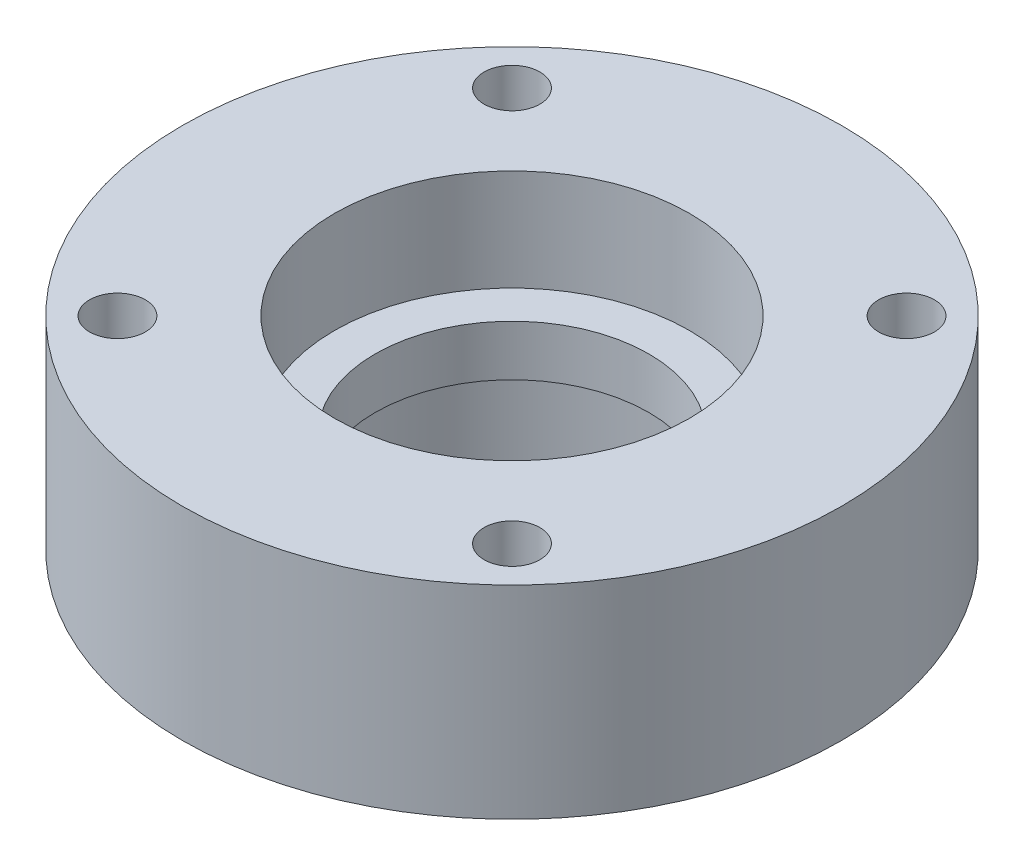
from build123d import *

# Parameters (mm, degrees)
HOLE_WIZARD_M51_D = 5.5


with BuildPart() as part:
    # Эскиз1 → Повернуть1 (revolve)
    with BuildSketch(Plane.XY, mode=Mode.PRIVATE) as revolve_1_sk:
        Polygon((13.5, 5), (13.5, 0), (17.5, 0), (17.5, -10), (22.5, -10), (22.5, -5), (32.5, -5), (32.5, 15), (17.5, 15), (17.5, 5), align=None)
    revolve(revolve_1_sk.sketch.rotate(Axis((0, 0, 0), (0, 1, 0)), 90), axis=Axis((0, 0, 0), (0, 1, 0)))

    # Отверстие с зазором M51 (through all)
    with Locations(Plane(origin=(0, 15, 0), x_dir=(-1, 0, 0), z_dir=(0, 1, 0))):
        with Locations((19.445436483, 19.445436483), (19.445436483, -19.445436483), (-19.445436483, -19.445436483), (-19.445436483, 19.445436483)):
            Hole(HOLE_WIZARD_M51_D / 2)


solid = part.part
